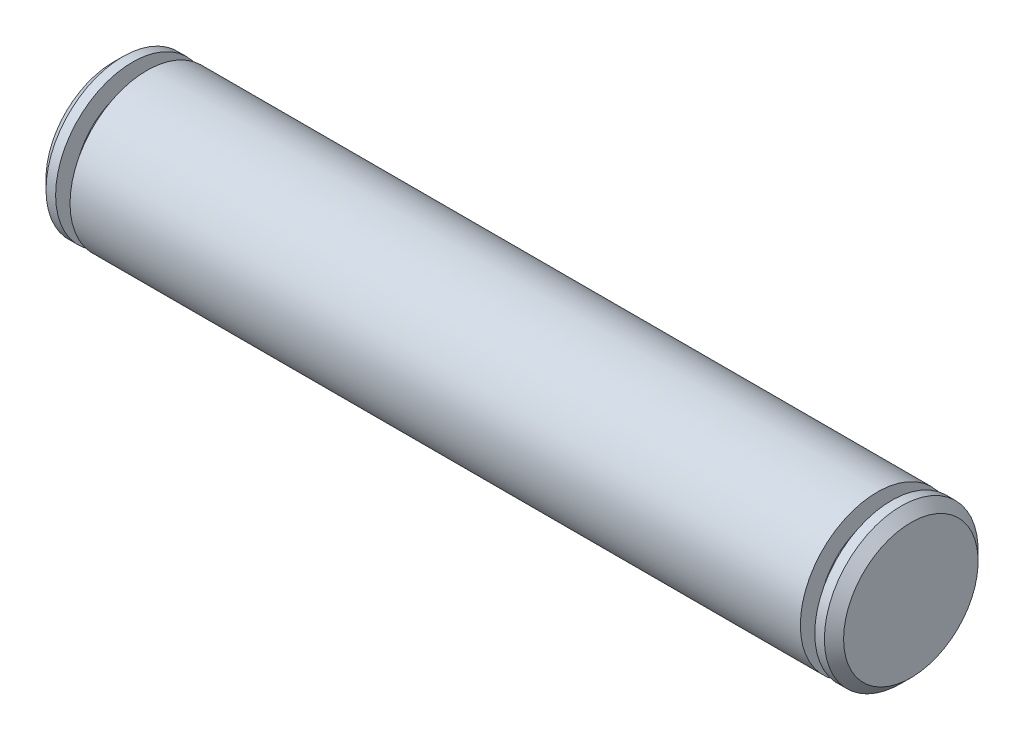
from build123d import *

# Parameters (mm, degrees)
CHAMFER1_SIZE = 1


with BuildPart() as part:
    # Sketch1 → Revolve1 (revolve)
    with BuildSketch(Plane.XY, mode=Mode.PRIVATE) as revolve1_sk:
        Polygon((-41.5, 0), (-41.5, 8), (-39.5, 8), (-39.5, 6), (-38, 6), (-38, 8), (38, 8), (38, 6), (39.5, 6), (39.5, 8), (41.5, 8), (41.5, 0), align=None)
    revolve(revolve1_sk.sketch.rotate(Axis((-47.151991765, 0, 0), (1, 0, 0)), 90), axis=Axis((-47.151991765, 0, 0), (1, 0, 0)))

    # Chamfer1
    chamfer1_edges = [part.edges().sort_by_distance(p)[0] for p in [
        (41.5, 0, -8),
        (-41.5, 0, -8),
    ]]
    chamfer(chamfer1_edges, length=CHAMFER1_SIZE)


solid = part.part
